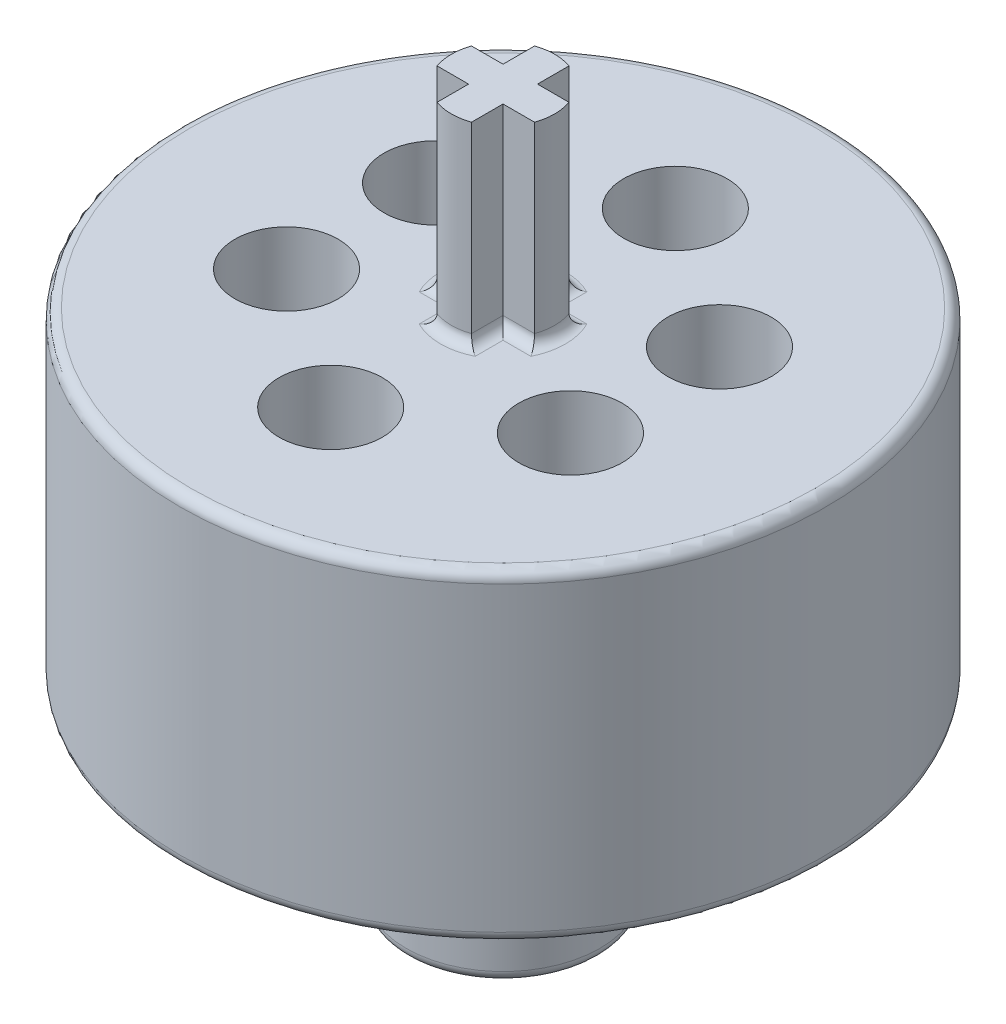
from build123d import *

# Parameters (mm, degrees)
ESBO_O2_R                = 15
RESSALTO_EXTRUS_O3_DEPTH = 15
ESBO_O1_R                = 2.4
CORTE_EXTRUS_O4_DEPTH    = 15
RESSALTO_EXTRUS_O4_DEPTH = 9
ESBO_O5_R                = 4.5
RESSALTO_EXTRUS_O5_DEPTH = 9
CORTE_EXTRUS_O7_DEPTH    = 7.5
FILETE3_R                = 0.5


with BuildPart() as part:
    # Esboço2 → Ressalto-extrusão3 (new body)
    with BuildSketch(Plane(origin=(0, 0, 0), x_dir=(1, 0, 0), z_dir=(0, 1, 0))):
        with Locations(Location((0, 0, 0), (0, 0, 270))):
            Circle(ESBO_O2_R)
    extrude(amount=RESSALTO_EXTRUS_O3_DEPTH)

    # Esboço1 → Corte-extrusão4 (cut)
    with BuildSketch(Plane(origin=(0, 0, 0), x_dir=(1, 0, 0), z_dir=(0, 1, 0))):
        with Locations(Location((-6.59, 3.46, 0), (0, 0, 270))):
            Circle(ESBO_O1_R)
        with Locations(Location((6.59, 3.46, 0), (0, 0, 270))):
            Circle(ESBO_O1_R)
        with Locations(Location((6.59, -3.46, 0), (0, 0, 90))):
            Circle(ESBO_O1_R)
        with Locations(Location((0, 8, 0), (0, 0, 270))):
            Circle(ESBO_O1_R)
        with Locations(Location((0, -8, 0), (0, 0, 90))):
            Circle(ESBO_O1_R)
        with Locations(Location((-6.59, -3.46, 0), (0, 0, 90))):
            Circle(ESBO_O1_R)
    extrude(amount=CORTE_EXTRUS_O4_DEPTH, mode=Mode.SUBTRACT)

    # Esboço3 → Ressalto-extrusão4 (add)
    with BuildSketch(Plane(origin=(0, 15, 0), x_dir=(1, 0, 0), z_dir=(0, 1, 0))):
        with BuildLine():
            Line((0.8, -0.8), (2.2627417, -0.8))
            ThreePointArc((2.2627417, -0.8), (2.4, 0), (2.2627417, 0.8))
            Line((2.2627417, 0.8), (0.8, 0.8))
            Line((0.8, 0.8), (0.8, 2.2627417))
            ThreePointArc((0.8, 2.2627417), (0, 2.4), (-0.8, 2.2627417))
            Line((-0.8, 2.2627417), (-0.8, 0.8))
            Line((-0.8, 0.8), (-2.2627417, 0.8))
            ThreePointArc((-2.2627417, 0.8), (-2.4, 0), (-2.2627417, -0.8))
            Line((-2.2627417, -0.8), (-0.8, -0.8))
            Line((-0.8, -0.8), (-0.8, -2.2627417))
            ThreePointArc((-0.8, -2.2627417), (0, -2.4), (0.8, -2.2627417))
            Line((0.8, -2.2627417), (0.8, -0.8))
        make_face()
    extrude(amount=RESSALTO_EXTRUS_O4_DEPTH)

    # Esboço5 → Ressalto-extrusão5 (add)
    with BuildSketch(Plane.XZ):
        with Locations(Location((0, 0, 0), (0, 0, 90))):
            Circle(ESBO_O5_R)
    extrude(amount=RESSALTO_EXTRUS_O5_DEPTH)

    # Esboço6 → Corte-extrusão7 (cut)
    with BuildSketch(Plane.XZ.offset(9)):
        with BuildLine():
            Line((1.878473588, -0.68653986), (0.915964349, 1.777922752))
            ThreePointArc((0.915964349, 1.777922752), (-1.862958624, -0.727588595), (1.878473588, -0.68653986))
        make_face()
    extrude(amount=-CORTE_EXTRUS_O7_DEPTH, mode=Mode.SUBTRACT)

    # Filete3
    filete3_edges = [part.edges().sort_by_distance(p)[0] for p in [
        (0, 0, -15),
        (1.53137085, 15, 0.8),
        (2.4, 15, 0),
        (0.8, 15, -1.53137085),
        (0, 15, -2.4),
        (-1.53137085, 15, -0.8),
        (-2.4, 15, 0),
        (0, 15, -15),
        (-0.8, 15, 1.53137085),
        (0, 15, 2.4),
        (0.8, 15, 1.53137085),
        (-1.53137085, 15, 0.8),
        (-0.8, 15, -1.53137085),
        (1.53137085, 15, -0.8),
        (0, 0, -4.5),
        (0, -9, -4.5),
    ]]
    fillet(filete3_edges, radius=FILETE3_R)


solid = part.part
